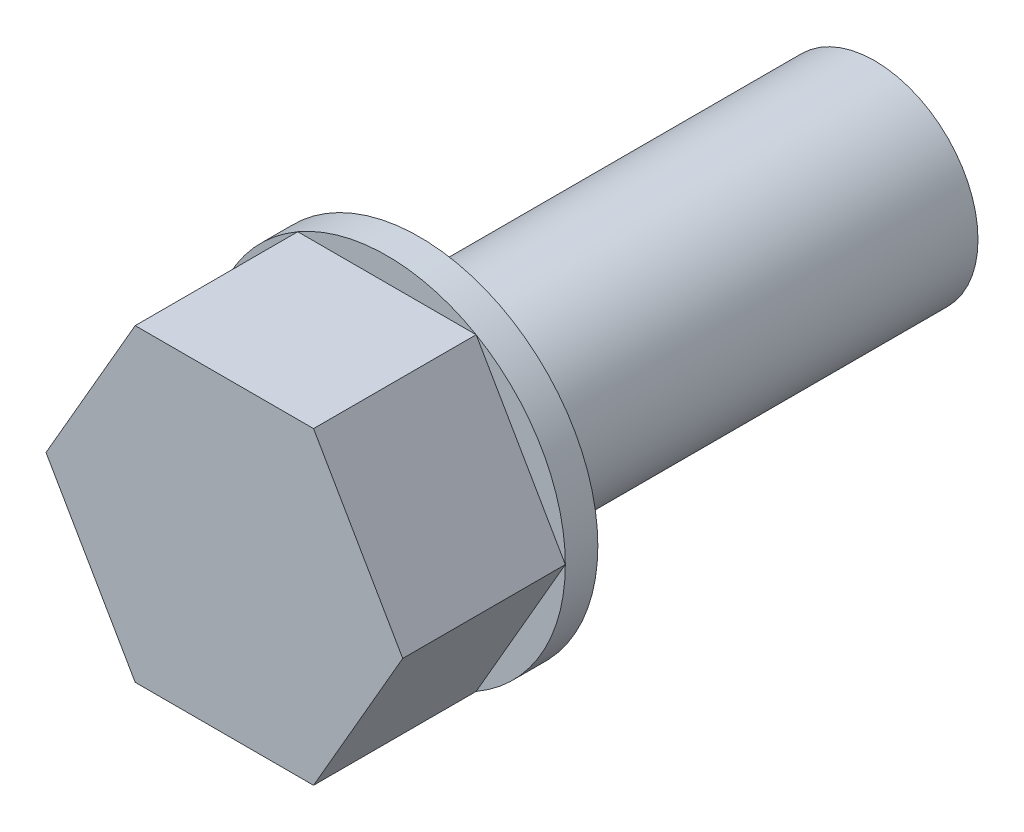
from build123d import *

# Parameters (mm, degrees)
CROQUIS1_R              = 6.35
SALIENTE_EXTRUIR1_DEPTH = 30
SALIENTE_EXTRUIR2_DEPTH = 10
CROQUIS3_R              = 10.969655115
SALIENTE_EXTRUIR3_DEPTH = 2


with BuildPart() as part:
    # Croquis1 → Saliente-Extruir1 (new body)
    with BuildSketch(Plane.XY):
        Circle(CROQUIS1_R)
    extrude(amount=SALIENTE_EXTRUIR1_DEPTH)

    # Croquis2 → Saliente-Extruir2 (add)
    with BuildSketch(Plane.XY.offset(30)):
        Polygon((10.969655115, 0), (5.484827557, 9.5), (-5.484827557, 9.5), (-10.969655115, 0), (-5.484827557, -9.5), (5.484827557, -9.5), align=None)
    extrude(amount=SALIENTE_EXTRUIR2_DEPTH)

    # Croquis3 → Saliente-Extruir3 (add)
    with BuildSketch(Plane(origin=(0, 0, 30), x_dir=(-1, 0, 0), z_dir=(0, 0, -1))):
        Circle(CROQUIS3_R)
    extrude(amount=SALIENTE_EXTRUIR3_DEPTH)


solid = part.part
